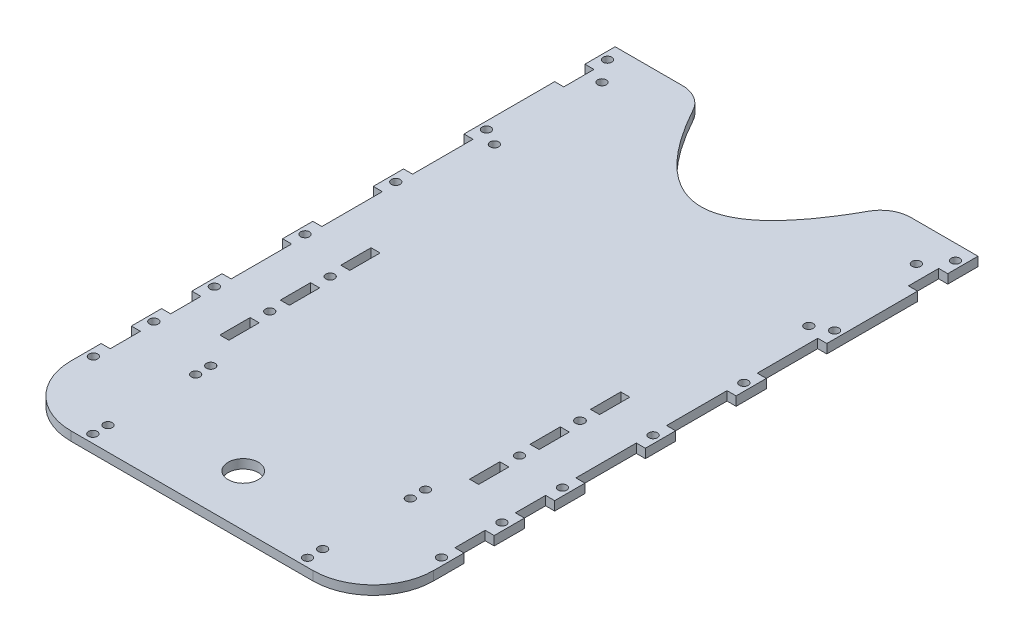
from build123d import *

# Parameters (mm, degrees)
SKETCH1_W           = 120
SKETCH1_H           = 200
BOSS_EXTRUDE1_DEPTH = 3
SKETCH2_R           = 5
SKETCH2_R_2         = 1.44
SKETCH2_W           = 3
SKETCH2_H           = 10
SKETCH2_R_3         = 1.5
CUT_EXTRUDE1_DEPTH  = 117.657618697
FILLET1_R           = 20
CUT_EXTRUDE2_DEPTH  = 117.657618697
FILLET2_R           = 10
SKETCH4_W           = 3
SKETCH4_H           = 10
SKETCH4_R           = 1.44
CUT_EXTRUDE3_DEPTH  = 3


with BuildPart() as part:
    # Sketch1 → Boss-Extrude1 (new body)
    with BuildSketch(Plane(origin=(0, 0, 0), x_dir=(1, 0, 0), z_dir=(0, 1, 0))):
        Rectangle(SKETCH1_W, SKETCH1_H)
    extrude(amount=BOSS_EXTRUDE1_DEPTH)

    # Sketch2 → Cut-Extrude1 (cut, through all)
    with BuildSketch(Plane(origin=(0, 3, 0), x_dir=(1, 0, 0), z_dir=(0, 1, 0))):
        with Locations(Location((0, -83, 0), (0, 0, 270))):
            Circle(SKETCH2_R)
        with Locations(Location((-35.5, -92.25, 0), (0, 0, 270))):
            Circle(SKETCH2_R_2)
        with Locations(Location((-35.5, -97.25, 0), (0, 0, 270))):
            Circle(SKETCH2_R_2)
        with Locations(Location((-35.5, -63.25, 0), (0, 0, 270))):
            Circle(SKETCH2_R_2)
        with Locations(Location((-35.5, -58.25, 0), (0, 0, 270))):
            Circle(SKETCH2_R_2)
        with Locations(Location((35.5, -58.25, 0), (0, 0, 270))):
            Circle(SKETCH2_R_2)
        with Locations(Location((35.5, -63.25, 0), (0, 0, 270))):
            Circle(SKETCH2_R_2)
        with Locations(Location((35.5, -97.25, 0), (0, 0, 270))):
            Circle(SKETCH2_R_2)
        with Locations(Location((35.5, -92.25, 0), (0, 0, 270))):
            Circle(SKETCH2_R_2)
        with Locations((41.295, -42.939307889)):
            Rectangle(SKETCH2_W, SKETCH2_H)
        with Locations(Location((41.295, -32.939307889, 0), (0, 0, 270))):
            Circle(SKETCH2_R_2)
        with Locations((41.295, -22.939307889)):
            Rectangle(SKETCH2_W, SKETCH2_H)
        with Locations((41.295, -2.939307889)):
            Rectangle(SKETCH2_W, SKETCH2_H)
        with Locations(Location((41.295, -12.939307889, 0), (0, 0, 270))):
            Circle(SKETCH2_R_3)
        with Locations((-41.295, -42.939307889)):
            Rectangle(SKETCH2_W, SKETCH2_H)
        with Locations(Location((-41.295, -32.939307889, 0), (0, 0, 270))):
            Circle(SKETCH2_R_2)
        with Locations((-41.295, -22.939307889)):
            Rectangle(SKETCH2_W, SKETCH2_H)
        with Locations(Location((-41.295, -12.939307889, 0), (0, 0, 270))):
            Circle(SKETCH2_R_2)
        with Locations((-41.295, -2.939307889)):
            Rectangle(SKETCH2_W, SKETCH2_H)
        with Locations(Location((52, 52.060692111, 0), (0, 0, 270))):
            Circle(SKETCH2_R_2)
        with Locations(Location((52, 87.620692111, 0), (0, 0, 270))):
            Circle(SKETCH2_R_2)
        with Locations(Location((-52, 52.060692111, 0), (0, 0, 270))):
            Circle(SKETCH2_R_2)
        with Locations(Location((-52, 87.620692111, 0), (0, 0, 270))):
            Circle(SKETCH2_R_2)
    extrude(amount=-CUT_EXTRUDE1_DEPTH, mode=Mode.SUBTRACT)

    # Fillet1
    fillet1_edges = [part.edges().sort_by_distance(p)[0] for p in [
        (60, 1.5, 100),
        (-60, 1.5, 100),
    ]]
    fillet(fillet1_edges, radius=FILLET1_R)

    # Sketch3 → Cut-Extrude2 (cut, through all)
    with BuildSketch(Plane(origin=(0, 3, 0), x_dir=(1, 0, 0), z_dir=(0, 1, 0))):
        with BuildLine():
            Line((-31.74050772, 100), (31.74050772, 100))
            add(Edge.make_bspline(
                [(-31.74050772, 100), (0, 36.741913205), (31.74050772, 100)],
                knots=[0, 0, 0, 1, 1, 1], degree=2))
        make_face()
    extrude(amount=-CUT_EXTRUDE2_DEPTH, mode=Mode.SUBTRACT)

    # Fillet2
    fillet2_edges = [part.edges().sort_by_distance(p)[0] for p in [
        (31.74050772, 1.5, -100),
        (-31.74050772, 1.5, -100),
    ]]
    fillet(fillet2_edges, radius=FILLET2_R)

    # Sketch4 → Cut-Extrude3 (cut)
    with BuildSketch(Plane(origin=(0, 3, 0), x_dir=(1, 0, 0), z_dir=(0, 1, 0))):
        with BuildLine():
            ThreePointArc((-56.12, -75), (-56.36, -74.20401005), (-57, -73.673350084))
            Line((-57, -73.673350084), (-57, -76.326649916))
            ThreePointArc((-57, -76.326649916), (-56.36, -75.79598995), (-56.12, -75))
        make_face()
        with BuildLine():
            Line((-57, -76.326649916), (-57, -73.673350084))
            ThreePointArc((-57, -73.673350084), (-59, -75), (-57, -76.326649916))
        make_face()
        with Locations((-58.5, -65)):
            Rectangle(SKETCH4_W, SKETCH4_H)
        with Locations((-58.5, -45)):
            Rectangle(SKETCH4_W, SKETCH4_H)
        with Locations((-58.5, -25)):
            Rectangle(SKETCH4_W, SKETCH4_H)
        with Locations((-58.5, -15)):
            Rectangle(SKETCH4_W, SKETCH4_H)
        with Locations((-58.5, 5)):
            Rectangle(SKETCH4_W, SKETCH4_H)
        with Locations((-58.5, 15)):
            Rectangle(SKETCH4_W, SKETCH4_H)
        with Locations((-58.5, 45)):
            Rectangle(SKETCH4_W, SKETCH4_H)
        with Locations((-58.5, 35)):
            Rectangle(SKETCH4_W, SKETCH4_H)
        with Locations((-58.5, 85)):
            Rectangle(SKETCH4_W, SKETCH4_H)
        with Locations(Location((-57.56, -55, 0), (0, 0, 270))):
            Circle(SKETCH4_R)
        with Locations(Location((-57.56, -35, 0), (0, 0, 270))):
            Circle(SKETCH4_R)
        with Locations(Location((-57.56, -5, 0), (0, 0, 270))):
            Circle(SKETCH4_R)
        with Locations(Location((-57.56, 25, 0), (0, 0, 270))):
            Circle(SKETCH4_R)
        with Locations(Location((-57.56, 55, 0), (0, 0, 270))):
            Circle(SKETCH4_R)
        with Locations(Location((-57.56, 95, 0), (0, 0, 270))):
            Circle(SKETCH4_R)
    cut_extrude3 = extrude(amount=-CUT_EXTRUDE3_DEPTH, mode=Mode.SUBTRACT)

    # Mirror1: Cut-Extrude3 across plane
    add(cut_extrude3.mirror(Plane(origin=(0, 0, 0), x_dir=(0, 0, 1), z_dir=(1, 0, 0))), mode=Mode.SUBTRACT)


solid = part.part
